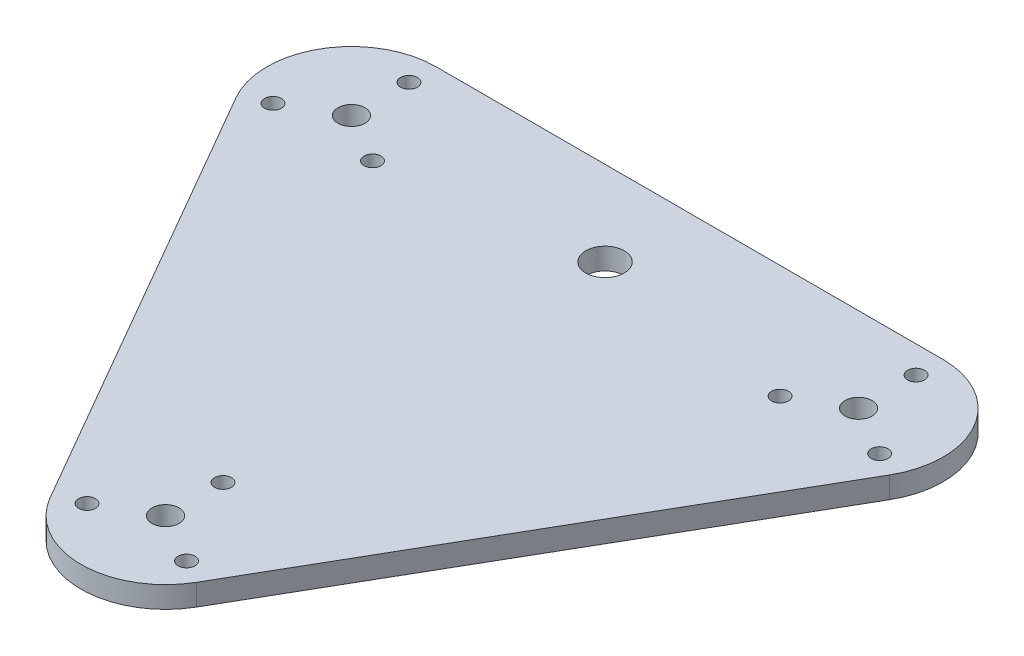
from build123d import *

# Parameters (mm, degrees)
ESQUISSE1_R             = 5.7
ESQUISSE1_R_2           = 4
BOSS_EXTRU_1_DEPTH      = 6.35
ESQUISSE4_R             = 2.5
ENL_V_MAT_EXTRU_1_DEPTH = 6.35


with BuildPart() as part:
    # Esquisse1 → Boss.-Extru.1 (new body)
    with BuildSketch(Plane(origin=(0, 0, 0), x_dir=(1, 0, 0), z_dir=(0, 1, 0))):
        with BuildLine():
            Line((-96.654639651, 52.506938663), (-21.654639651, -77.493061337))
            ThreePointArc((-21.654639651, -77.493061337), (0, -90), (21.654639651, -77.493061337))
            Line((21.654639651, -77.493061337), (96.654639651, 52.506938663))
            ThreePointArc((96.654639651, 52.506938663), (96.648631983, 77.50346885), (75, 90))
            Line((75, 90), (-75, 90))
            ThreePointArc((-75, 90), (-96.648631983, 77.50346885), (-96.654639651, 52.506938663))
        make_face()
        with Locations(Location((0, 65, 0), (0, 0, 270))):
            Circle(ESQUISSE1_R, mode=Mode.SUBTRACT)
        with Locations(Location((-75, 65, 0), (0, 0, 270))):
            Circle(ESQUISSE1_R_2, mode=Mode.SUBTRACT)
        with Locations(Location((75, 65, 0), (0, 0, 270))):
            Circle(ESQUISSE1_R_2, mode=Mode.SUBTRACT)
        with Locations(Location((0, -65, 0), (0, 0, 270))):
            Circle(ESQUISSE1_R_2, mode=Mode.SUBTRACT)
    extrude(amount=BOSS_EXTRU_1_DEPTH)

    # Esquisse4 → Enlèv. mat.-Extru.1 (cut)
    with BuildSketch(Plane.XZ):
        with Locations(Location((-75, -82, 0), (0, 0, 90))):
            Circle(ESQUISSE4_R)
        with Locations(Location((-89.722431864, -56.5, 0), (0, 0, 90))):
            Circle(ESQUISSE4_R)
        with Locations(Location((-60.277568136, -56.5, 0), (0, 0, 90))):
            Circle(ESQUISSE4_R)
        with Locations(Location((60.277568136, -56.5, 0), (0, 0, 90))):
            Circle(ESQUISSE4_R)
        with Locations(Location((75, -82, 0), (0, 0, 90))):
            Circle(ESQUISSE4_R)
        with Locations(Location((89.722431864, -56.5, 0), (0, 0, 90))):
            Circle(ESQUISSE4_R)
        with Locations(Location((-14.722431864, 73.5, 0), (0, 0, 90))):
            Circle(ESQUISSE4_R)
        with Locations(Location((0, 48, 0), (0, 0, 90))):
            Circle(ESQUISSE4_R)
        with Locations(Location((14.722431864, 73.5, 0), (0, 0, 90))):
            Circle(ESQUISSE4_R)
    extrude(amount=-ENL_V_MAT_EXTRU_1_DEPTH, mode=Mode.SUBTRACT)


solid = part.part
